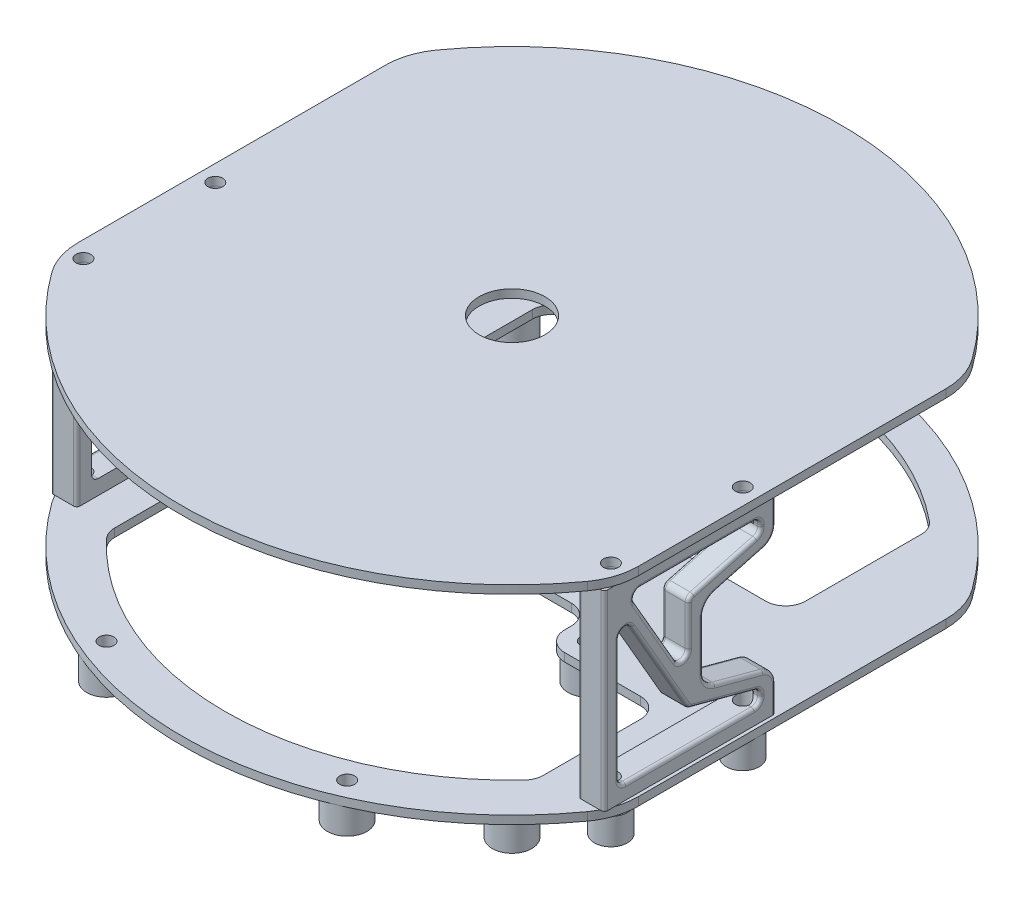
from build123d import *

# Parameters (mm, degrees)
BOSS_EXTRUDE1_DEPTH = 1.25
SKETCH2_R           = 3
SKETCH2_R_2         = 1.125
BOSS_EXTRUDE2_DEPTH = 4
FILLET1_R           = 10
SKETCH4_R           = 3
SKETCH4_R_2         = 2.5
BOSS_EXTRUDE3_DEPTH = 4
SKETCH3_R           = 1.125
CUT_EXTRUDE1_DEPTH  = 66.831698292
CUT_EXTRUDE2_DEPTH  = 66.743821002
FILLET2_R           = 3
BOSS_EXTRUDE4_DEPTH = 2
FILLET3_R           = 2.5
FILLET4_R           = 1
FILLET5_R           = 0.5
CUT_EXTRUDE3_START  = -3.5
SKETCH8_R           = 1.125
CUT_EXTRUDE3_DEPTH  = 3.5
CUT_EXTRUDE4_START  = -29
SKETCH8_3_R         = 1.125
CUT_EXTRUDE4_DEPTH  = 3.5
SKETCH9_R           = 5
BOSS_EXTRUDE6_DEPTH = 1.25
SKETCH10_R          = 1.125
CUT_EXTRUDE5_DEPTH  = 75.022378373


with BuildPart() as part:
    # Sketch1 → Boss-Extrude1 (new body)
    with BuildSketch(Plane(origin=(0, 0, 0), x_dir=(1, 0, 0), z_dir=(0, 1, 0))):
        with BuildLine():
            Line((-42.5, 26.339134382), (-42.5, -26.339134382))
            ThreePointArc((-42.5, -26.339134382), (0, -50), (42.5, -26.339134382))
            Line((42.5, -26.339134382), (42.5, 26.339134382))
            ThreePointArc((42.5, 26.339134382), (0, 50), (-42.5, 26.339134382))
        make_face()
    extrude(amount=BOSS_EXTRUDE1_DEPTH)

    # Sketch2 → Boss-Extrude2 (add)
    # profile 1 of 4: a face of its own
    with BuildSketch(Plane.XZ):
        with Locations(Location((-33, 33, 0), (0, 0, 90))):
            Circle(SKETCH2_R)
        with Locations(Location((-33, 33, 0), (0, 0, 270))):
            Circle(SKETCH2_R_2, mode=Mode.SUBTRACT)
    # profile 2 of 4: a face of its own
    with BuildSketch(Plane.XZ):
        with Locations(Location((-33, -33, 0), (0, 0, 90))):
            Circle(SKETCH2_R)
        with Locations(Location((-33, -33, 0), (0, 0, 90))):
            Circle(SKETCH2_R_2, mode=Mode.SUBTRACT)
    # profile 3 of 4: a face of its own
    with BuildSketch(Plane.XZ):
        with Locations(Location((33, -33, 0), (0, 0, 90))):
            Circle(SKETCH2_R)
        with Locations(Location((33, -33, 0), (0, 0, 270))):
            Circle(SKETCH2_R_2, mode=Mode.SUBTRACT)
    # profile 4 of 4: a face of its own
    with BuildSketch(Plane.XZ):
        with Locations(Location((33, 33, 0), (0, 0, 90))):
            Circle(SKETCH2_R)
        with Locations(Location((33, 33, 0), (0, 0, 90))):
            Circle(SKETCH2_R_2, mode=Mode.SUBTRACT)
    extrude(amount=BOSS_EXTRUDE2_DEPTH)

    # Fillet1
    fillet1_edges = [part.edges().sort_by_distance(p)[0] for p in [
        (42.5, 0.625, -26.339134382),
        (42.5, 0.625, 26.339134382),
        (-42.5, 0.625, 26.339134382),
        (-42.5, 0.625, -26.339134382),
    ]]
    fillet(fillet1_edges, radius=FILLET1_R)

    # Sketch4 → Boss-Extrude3 (add)
    with BuildSketch(Plane.XZ):
        with Locations(Location((-18.25, 43.25, 0), (0, 0, 90))):
            Circle(SKETCH4_R)
        with Locations(Location((18.25, 43.25, 0), (0, 0, 90))):
            Circle(SKETCH4_R)
        with Locations(Location((18.25, 6.75, 0), (0, 0, 90))):
            Circle(SKETCH4_R)
        with Locations(Location((-18.25, 6.75, 0), (0, 0, 90))):
            Circle(SKETCH4_R)
        with Locations(Location((-40, 25, 0), (0, 0, 141.811465123))):
            Circle(SKETCH4_R_2)
        with Locations(Location((-40, 5, 0), (0, 0, 180))):
            Circle(SKETCH4_R_2)
        with Locations(Location((40, 25, 0), (0, 0, 38.188534877))):
            Circle(SKETCH4_R_2)
        with Locations((40, 5)):
            Circle(SKETCH4_R_2)
    extrude(amount=BOSS_EXTRUDE3_DEPTH)

    # Sketch3 → Cut-Extrude1 (cut, through all)
    with BuildSketch(Plane(origin=(0, 1.25, 0), x_dir=(1, 0, 0), z_dir=(0, 1, 0))):
        with Locations(Location((-18.25, -6.75, 0), (0, 0, 270))):
            Circle(SKETCH3_R)
        with Locations(Location((18.25, -6.75, 0), (0, 0, 270))):
            Circle(SKETCH3_R)
        with Locations(Location((18.25, -43.25, 0), (0, 0, 270))):
            Circle(SKETCH3_R)
        with Locations(Location((-18.25, -43.25, 0), (0, 0, 270))):
            Circle(SKETCH3_R)
        with Locations(Location((-40, -5, 0), (0, 0, 270))):
            Circle(SKETCH3_R)
        with Locations(Location((-40, -25, 0), (0, 0, 270))):
            Circle(SKETCH3_R)
        with Locations(Location((40, -25, 0), (0, 0, 270))):
            Circle(SKETCH3_R)
        with Locations(Location((40, -5, 0), (0, 0, 270))):
            Circle(SKETCH3_R)
    extrude(amount=-CUT_EXTRUDE1_DEPTH, mode=Mode.SUBTRACT)

    # Sketch6 → Cut-Extrude2 (cut, through all)
    with BuildSketch(Plane.XZ):
        with BuildLine():
            Line((-29.5, -33.981612675), (-29.5, -12))
            Line((-29.5, -12), (-6, -12))
            Line((-6, -12), (-6, -44.598206242))
            ThreePointArc((-6, -44.598206242), (-18.526751327, -41.009260969), (-29.5, -33.981612675))
        make_face()
        with BuildLine():
            Line((29.5, -12), (29.5, -33.981612675))
            ThreePointArc((29.5, -33.981612675), (18.526751327, -41.009260969), (6, -44.598206242))
            Line((6, -44.598206242), (6, -12))
            Line((6, -12), (29.5, -12))
        make_face()
        with BuildLine():
            Line((-32.5, 28.91366459), (-32.5, 10))
            Line((-32.5, 10), (-15, 10))
            Line((-15, 10), (-15, 3))
            Line((-15, 3), (15, 3))
            Line((15, 3), (15, 10))
            Line((15, 10), (32.5, 10))
            Line((32.5, 10), (32.5, 28.91366459))
            ThreePointArc((32.5, 28.91366459), (0, 43.5), (-32.5, 28.91366459))
        make_face()
    extrude(amount=-CUT_EXTRUDE2_DEPTH, mode=Mode.SUBTRACT)

    # Fillet2
    fillet2_edges = [part.edges().sort_by_distance(p)[0] for p in [
        (-32.5, 0.625, 28.91366459),
        (32.5, 0.625, 28.91366459),
        (32.5, 0.625, 10),
        (15, 0.625, 10),
        (15, 0.625, 3),
        (-15, 0.625, 3),
        (-15, 0.625, 10),
        (-32.5, 0.625, 10),
        (6, 0.625, -12),
        (29.5, 0.625, -12),
        (29.5, 0.625, -33.981612675),
        (6, 0.625, -44.598206242),
        (-6, 0.625, -44.598206242),
        (-29.5, 0.625, -33.981612675),
        (-29.5, 0.625, -12),
        (-6, 0.625, -12),
    ]]
    fillet(fillet2_edges, radius=FILLET2_R)


with BuildPart() as body_2:
    # Sketch7 → Boss-Extrude4 (new, symmetric)
    with BuildSketch(Plane.ZY.offset(40)):
        Polygon((2, 1.25), (2, 7.25), (13, 10.197441117), (13, 21.302558883), (2, 24.25), (2, 30.25), (28, 30.25), (28, 1.25), align=None)
        Polygon((4.25, 28), (24.215698084, 28), (15.25, 12.470955394), (15.25, 23.029044606), (4.25, 25.976485723), align=None, mode=Mode.SUBTRACT)
        Polygon((25.75, 3.5), (4.25, 3.5), (4.25, 5.523514277), (15.25, 8.470955394), (25.75, 26.657488873), align=None, mode=Mode.SUBTRACT)
    extrude(amount=BOSS_EXTRUDE4_DEPTH, both=True)

    # Fillet3
    fillet3_edges = [body_2.edges().sort_by_distance(p)[0] for p in [
        (-40, 7.25, 2),
        (-40, 10.197441117, 13),
        (-40, 21.302558883, 13),
        (-40, 24.25, 2),
    ]]
    fillet(fillet3_edges, radius=FILLET3_R)

    # Fillet4
    fillet4_edges = [body_2.edges().sort_by_distance(p)[0] for p in [
        (-40, 28, 4.25),
        (-40, 25.976485723, 4.25),
        (-40, 23.029044606, 15.25),
        (-40, 12.470955394, 15.25),
        (-40, 28, 24.215698084),
        (-40, 3.5, 25.75),
        (-40, 26.657488873, 25.75),
        (-40, 8.470955394, 15.25),
        (-40, 5.523514277, 4.25),
        (-40, 3.5, 4.25),
    ]]
    fillet(fillet4_edges, radius=FILLET4_R)

    # Fillet5
    fillet5_edges = [body_2.edges().sort_by_distance(p)[0] for p in [
        (-42, 26.871906355, 4.25),
        (-42, 19.23236191, 15.25),
        (-38, 28.209158735, 2),
        (-42, 24.502765165, 9.75),
        (-42, 3.5, 15),
        (-42, 4.628093645, 4.25),
        (-42, 22.870479047, 15.04335334),
        (-42, 8.536321521, 15.199842806),
        (-38, 15.75, 28),
        (-38, 27.5, 23.34967268),
        (-42, 27.5, 23.34967268),
        (-42, 23.891363892, 25.008819045),
        (-42, 5.364948718, 4.45664666),
        (-42, 3.792893219, 25.457106781),
        (-42, 3.792893219, 4.542893219),
        (-38, 15.237080375, 15.991180955),
        (-42, 15.237080375, 15.991180955),
        (-38, 27.707106781, 4.542893219),
        (-42, 27.707106781, 4.542893219),
        (-38, 26.135051282, 4.45664666),
        (-42, 26.135051282, 4.45664666),
        (-42, 28.209158735, 2),
        (-38, 3.290841265, 2),
        (-42, 3.290841265, 2),
        (-38, 8.723720558, 7.5),
        (-38, 15.75, 13),
        (-38, 22.776279442, 7.5),
        (-38, 24.646413897, 2.516616649),
        (-38, 6.853586103, 2.516616649),
        (-42, 8.723720558, 7.5),
        (-42, 22.776279442, 7.5),
        (-42, 15.75, 13),
        (-42, 24.646413897, 2.516616649),
        (-42, 6.853586103, 2.516616649),
        (-38, 10.593855014, 12.483383351),
        (-42, 10.593855014, 12.483383351),
        (-38, 20.906144986, 12.483383351),
        (-42, 20.906144986, 12.483383351),
        (-38, 21.101503101, 20.232849042),
        (-42, 21.101503101, 20.232849042),
        (-38, 28, 13.866823638),
        (-42, 28, 13.866823638),
        (-42, 15.75, 28),
        (-42, 13.712719033, 25.75),
        (-42, 16.127556464, 19.670540689),
        (-38, 26.871906355, 4.25),
        (-38, 24.502765165, 9.75),
        (-38, 19.23236191, 15.25),
        (-38, 22.870479047, 15.04335334),
        (-42, 7.042931075, 9.920540689),
    ]]
    fillet(fillet5_edges, radius=FILLET5_R)

    # Sketch8 → Cut-Extrude3 (cut)
    with BuildSketch(Plane.XZ.offset(-1.25).offset(CUT_EXTRUDE3_START)):
        with Locations(Location((-40, 5, 0), (0, 0, 270))):
            Circle(SKETCH8_R)
        with Locations(Location((-40, 25, 0), (0, 0, 270))):
            Circle(SKETCH8_R)
    extrude(amount=CUT_EXTRUDE3_DEPTH, mode=Mode.SUBTRACT)

    # Sketch8<3> → Cut-Extrude4 (cut)
    with BuildSketch(Plane.XZ.offset(-1.25).offset(CUT_EXTRUDE4_START)):
        with Locations(Location((-40, 5, 0), (0, 0, 270))):
            Circle(SKETCH8_3_R)
        with Locations(Location((-40, 25, 0), (0, 0, 270))):
            Circle(SKETCH8_3_R)
    extrude(amount=CUT_EXTRUDE4_DEPTH, mode=Mode.SUBTRACT)


with BuildPart() as body_3:
    # Mirror1: mirrored copy
    add(body_2.part.mirror(Plane(origin=(0, 0, 0), x_dir=(0, 0, 1), z_dir=(1, 0, 0))))


with BuildPart() as body_4:
    # Sketch9 → Boss-Extrude6 (new body)
    with BuildSketch(Plane(origin=(0, 30.25, 0), x_dir=(1, 0, 0), z_dir=(0, 1, 0))):
        with BuildLine():
            Line((-42.5, 23.318447633), (-42.5, -23.318447633))
            ThreePointArc((-42.5, -23.318447633), (-42.019716382, -26.380309811), (-40.625, -29.148059541))
            ThreePointArc((-40.625, -29.148059541), (0, -50), (40.625, -29.148059541))
            ThreePointArc((40.625, -29.148059541), (42.019716382, -26.380309811), (42.5, -23.318447633))
            Line((42.5, -23.318447633), (42.5, 23.318447633))
            ThreePointArc((42.5, 23.318447633), (42.019716382, 26.380309811), (40.625, 29.148059541))
            ThreePointArc((40.625, 29.148059541), (0, 50), (-40.625, 29.148059541))
            ThreePointArc((-40.625, 29.148059541), (-42.019716382, 26.380309811), (-42.5, 23.318447633))
        make_face()
        with Locations(Location((0, 0, 0), (0, 0, 270))):
            Circle(SKETCH9_R, mode=Mode.SUBTRACT)
    extrude(amount=BOSS_EXTRUDE6_DEPTH)

    # Sketch10 → Cut-Extrude5 (cut, through all)
    with BuildSketch(Plane.XZ.offset(-30.25)):
        with Locations(Location((-40, 5, 0), (0, 0, 270))):
            Circle(SKETCH10_R)
        with Locations(Location((-40, 25, 0), (0, 0, 270))):
            Circle(SKETCH10_R)
        with Locations(Location((40, 25, 0), (0, 0, 90))):
            Circle(SKETCH10_R)
        with Locations(Location((40, 5, 0), (0, 0, 90))):
            Circle(SKETCH10_R)
    extrude(amount=-CUT_EXTRUDE5_DEPTH, mode=Mode.SUBTRACT)


solid = Compound([part.part, body_2.part, body_3.part, body_4.part])
